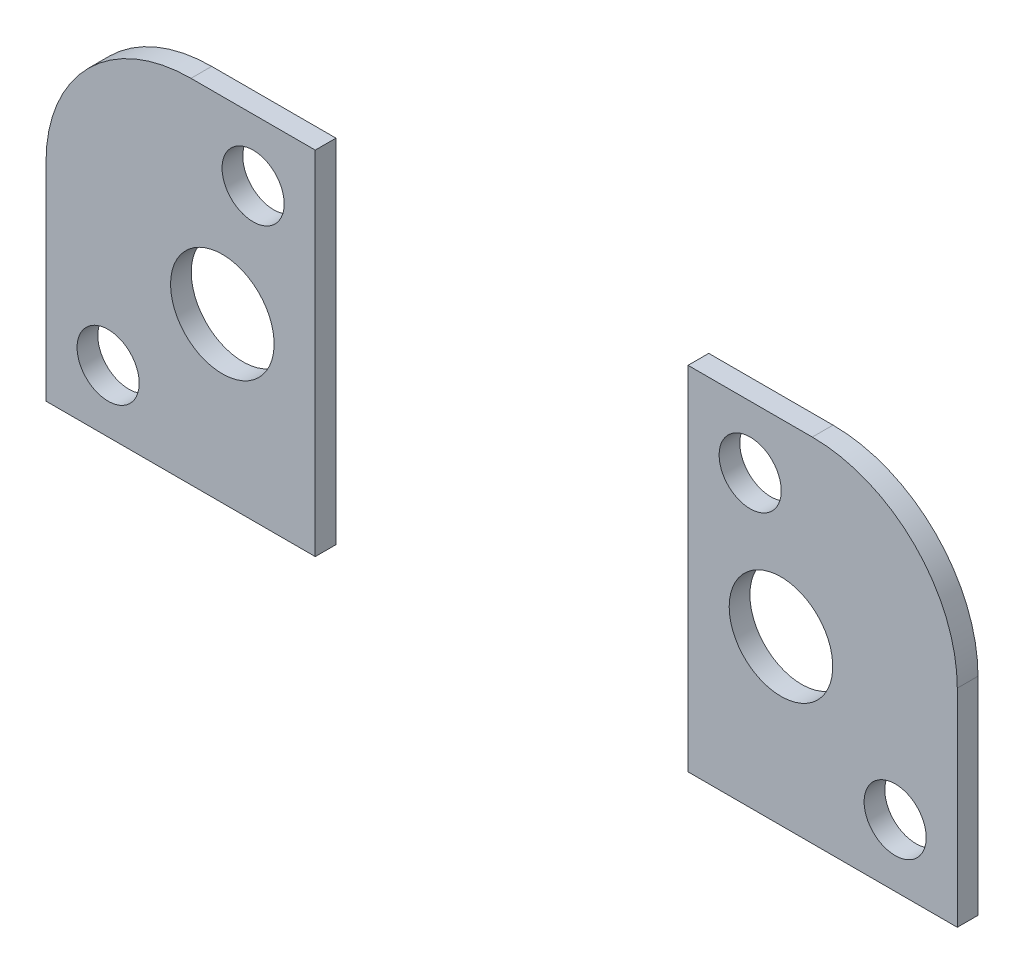
from build123d import *

# Parameters (mm, degrees)
SKETCH_2_R        = 2.5
SKETCH_2_R_2      = 1.5
EXTRUDE_2_DEPTH   = 1
EXTRUDE_2_2_DEPTH = 1


with BuildPart() as part:
    # 草图2 → 凸台-拉伸2 (new body)
    with BuildSketch(Plane(origin=(0, 0, 993.809706351), x_dir=(-1, 0, 0), z_dir=(0, 0, -1))):
        with BuildLine():
            Line((-9.372681611, 7.329507903), (-15.372681611, 7.329507903))
            ThreePointArc((-15.372681611, 7.329507903), (-20.32242908, 5.279255371), (-22.372681611, 0.329507903))
            Line((-22.372681611, 0.329507903), (-22.372681611, -9.670492097))
            Line((-22.372681611, -9.670492097), (-16.372681611, -9.670492097))
            Line((-16.372681611, -9.670492097), (-9.372681611, -9.670492097))
            Line((-9.372681611, -9.670492097), (-9.372681611, 7.329507903))
        make_face()
        with Locations((-13.859341687, -1.770492097)):
            Circle(SKETCH_2_R, mode=Mode.SUBTRACT)
        with Locations((-12.372681611, 4.329507903)):
            Circle(SKETCH_2_R_2, mode=Mode.SUBTRACT)
        with Locations((-19.372681611, -6.670492097)):
            Circle(SKETCH_2_R_2, mode=Mode.SUBTRACT)
    extrude(amount=EXTRUDE_2_DEPTH)


with BuildPart() as body_2:
    # 草图2 → Extrude 2 2 (new body)
    with BuildSketch(Plane(origin=(0, 0, 993.809706351), x_dir=(-1, 0, 0), z_dir=(0, 0, -1))):
        with BuildLine():
            Line((8.627318389, 7.329507903), (8.627318389, -9.670492097))
            Line((8.627318389, -9.670492097), (21.627318389, -9.670492097))
            Line((21.627318389, -9.670492097), (21.627318389, 0.329507903))
            ThreePointArc((21.627318389, 0.329507903), (19.577065857, 5.279255371), (14.627318389, 7.329507903))
            Line((14.627318389, 7.329507903), (8.627318389, 7.329507903))
        make_face()
        with Locations((13.113978464, -1.770492097)):
            Circle(SKETCH_2_R, mode=Mode.SUBTRACT)
        with Locations((11.627318389, 4.329507903)):
            Circle(SKETCH_2_R_2, mode=Mode.SUBTRACT)
        with Locations((18.627318389, -6.670492097)):
            Circle(SKETCH_2_R_2, mode=Mode.SUBTRACT)
    extrude(amount=EXTRUDE_2_2_DEPTH)


solid = Compound([part.part, body_2.part])
